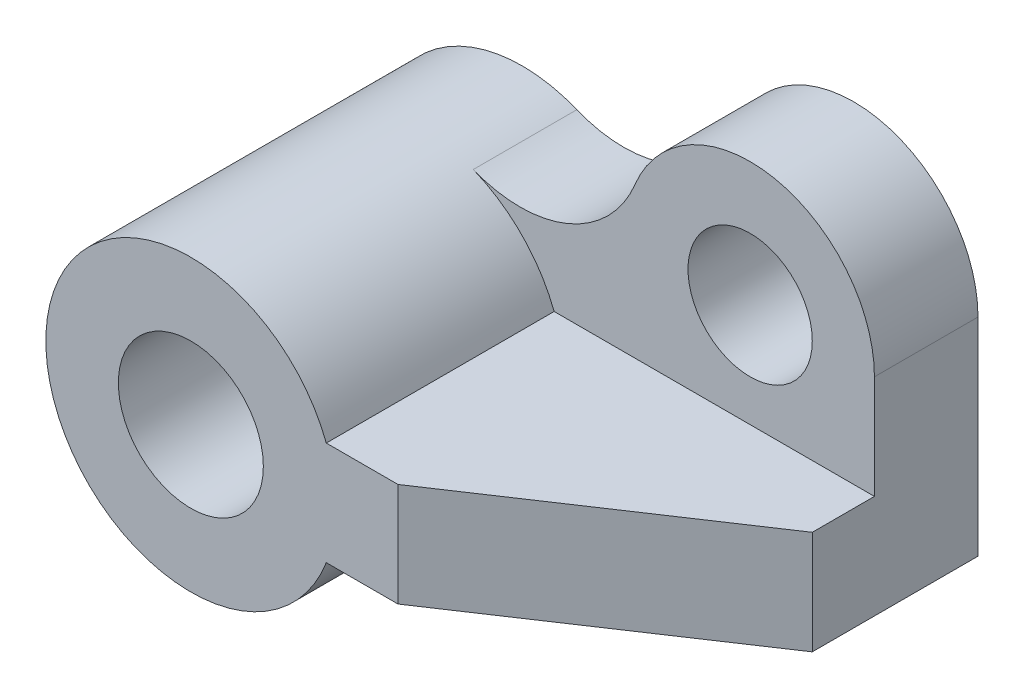
from build123d import *

# Parameters (mm, degrees)
SKETCH1_R           = 7
BOSS_EXTRUDE1_DEPTH = 32
SKETCH1_3_R         = 6
BOSS_EXTRUDE2_DEPTH = 10
CHAMFER1_SIZE       = 16
CHAMFER1_SIZE2      = 24


with BuildPart() as part:
    # Sketch1 → Boss-Extrude1 (new body)
    with BuildSketch(Plane.XY):
        with BuildLine():
            ThreePointArc((5.269950687, 12.970259047), (-12.84065502, -5.578313245), (13.076696831, -5))
            Line((13.076696831, -5), (44, -5))
            Line((44, -5), (44, 5))
            Line((44, 5), (20, 5))
            Line((20, 5), (13.076696831, 5))
            ThreePointArc((13.076696831, 5), (10.001556184, 9.796370445), (5.269950687, 12.970259047))
        make_face()
        Circle(SKETCH1_R, mode=Mode.SUBTRACT)
    extrude(amount=BOSS_EXTRUDE1_DEPTH)

    # Sketch1<3> → Boss-Extrude2 (add)
    with BuildSketch(Plane.XY):
        with BuildLine():
            ThreePointArc((20.893525638, 19.543811973), (14.440852002, 13.026785876), (5.269950687, 12.970259047))
            ThreePointArc((5.269950687, 12.970259047), (10.001556184, 9.796370445), (13.076696831, 5))
            Line((13.076696831, 5), (20, 5))
            Line((20, 5), (44, 5))
            Line((44, 5), (44, 15))
            ThreePointArc((44, 15), (34.315416556, 26.774499827), (20.893525638, 19.543811973))
        make_face()
        with Locations((32, 15)):
            Circle(SKETCH1_3_R, mode=Mode.SUBTRACT)
    extrude(amount=BOSS_EXTRUDE2_DEPTH)

    # Chamfer1
    chamfer1_edges = [part.edges().sort_by_distance(p)[0] for p in [
        (44, 0, 32),
    ]]
    chamfer1_side = [part.faces().sort_by_distance(p)[0] for p in [
        (44, 2.380952381, 13.380952381),
    ]]
    chamfer(chamfer1_edges, length=CHAMFER1_SIZE, length2=CHAMFER1_SIZE2, reference=chamfer1_side[0])


solid = part.part
